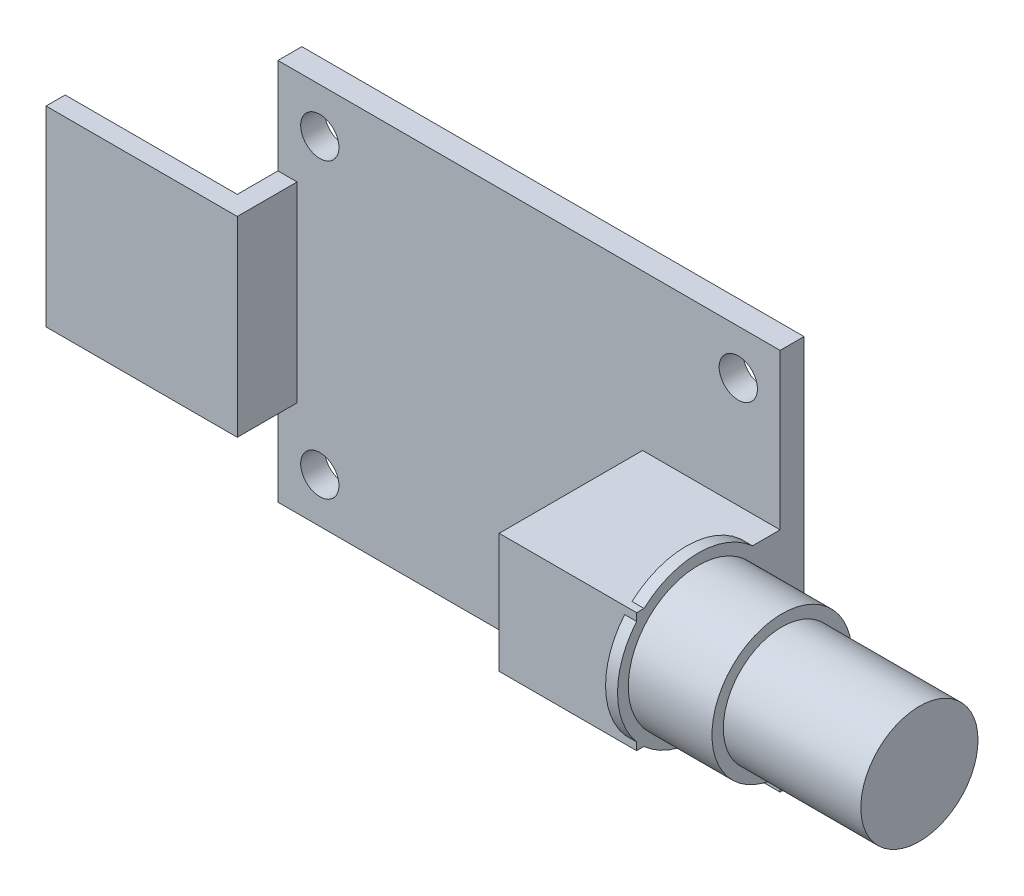
from build123d import *

# Parameters (mm, degrees)
CROQUIS1_W              = 42
CROQUIS1_H              = 32
CROQUIS1_R              = 1.6
SALIENTE_EXTRUIR1_DEPTH = 2
CROQUIS2_W              = 11.5
CROQUIS2_H              = 10
SALIENTE_EXTRUIR2_DEPTH = 12
SALIENTE_EXTRUIR3_START = -1
CROQUIS3_R              = 6.75
SALIENTE_EXTRUIR3_DEPTH = 19.5
CORTAR_EXTRUIR1_START   = -18.5
CROQUIS4_R              = 6.75
CROQUIS4_R_2            = 5.85
CORTAR_EXTRUIR1_DEPTH   = 18.5
CORTAR_EXTRUIR2_START   = -11.5
CROQUIS5_R              = 5.85
CROQUIS5_R_2            = 4.9
CORTAR_EXTRUIR2_DEPTH   = 11.5
SALIENTE_EXTRUIR4_DEPTH = 8


with BuildPart() as part:
    # Croquis1 → Saliente-Extruir1 (new body)
    with BuildSketch(Plane.XY):
        Rectangle(CROQUIS1_W, CROQUIS1_H)
        with Locations((-17.5, 12.25)):
            Circle(CROQUIS1_R, mode=Mode.SUBTRACT)
        with Locations((-17.5, -12.25)):
            Circle(CROQUIS1_R, mode=Mode.SUBTRACT)
        with Locations((17.5, -12.25)):
            Circle(CROQUIS1_R, mode=Mode.SUBTRACT)
        with Locations((17.5, 12.25)):
            Circle(CROQUIS1_R, mode=Mode.SUBTRACT)
    extrude(amount=SALIENTE_EXTRUIR1_DEPTH)

    # Croquis2 → Saliente-Extruir2 (add)
    with BuildSketch(Plane.XY.offset(2)):
        with Locations((15.25, -2)):
            Rectangle(CROQUIS2_W, CROQUIS2_H)
    extrude(amount=SALIENTE_EXTRUIR2_DEPTH)

    # Croquis3 → Saliente-Extruir3 (add)
    with BuildSketch(Plane(origin=(21, 0, 0), x_dir=(0, 0, -1), z_dir=(1, 0, 0)).offset(SALIENTE_EXTRUIR3_START)):
        with Locations(Location((-8.85, -2, 0), (0, 0, 220.27389294))):
            Circle(CROQUIS3_R)
    extrude(amount=SALIENTE_EXTRUIR3_DEPTH)

    # Croquis4 → Cortar-Extruir1 (cut)
    with BuildSketch(Plane(origin=(39.5, 0, 0), x_dir=(0, 0, -1), z_dir=(1, 0, 0)).offset(CORTAR_EXTRUIR1_START)):
        with Locations((-8.85, -2)):
            Circle(CROQUIS4_R)
        with Locations((-8.85, -2)):
            Circle(CROQUIS4_R_2, mode=Mode.SUBTRACT)
    extrude(amount=CORTAR_EXTRUIR1_DEPTH, mode=Mode.SUBTRACT)

    # Croquis5 → Cortar-Extruir2 (cut)
    with BuildSketch(Plane(origin=(39.5, 0, 0), x_dir=(0, 0, -1), z_dir=(1, 0, 0)).offset(CORTAR_EXTRUIR2_START)):
        with Locations((-8.85, -2)):
            Circle(CROQUIS5_R)
        with Locations((-8.85, -2)):
            Circle(CROQUIS5_R_2, mode=Mode.SUBTRACT)
    extrude(amount=CORTAR_EXTRUIR2_DEPTH, mode=Mode.SUBTRACT)

    # Croquis7 → Saliente-Extruir4 (add, symmetric)
    with BuildSketch(Plane(origin=(0, 0, 0), x_dir=(1, 0, 0), z_dir=(0, 1, 0))):
        Polygon((-21, -2), (-21, -5.4), (-35.4, -5.4), (-35.4, -7), (-19.4, -7), (-19.4, -2), align=None)
    extrude(amount=SALIENTE_EXTRUIR4_DEPTH, both=True)


solid = part.part
